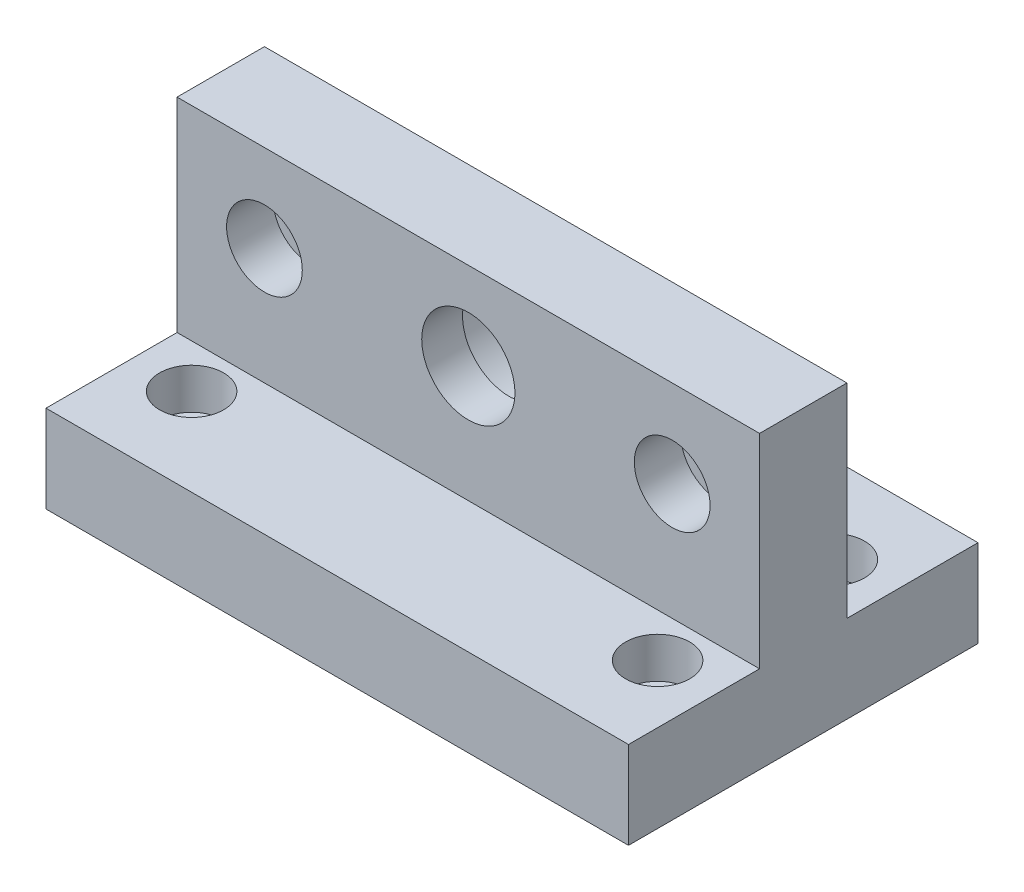
from build123d import *

# Parameters (mm, degrees)
SKETCH_1_W          = 100
SKETCH_1_H          = 35
EXTRUDE_1_DEPTH     = 15
SKETCH_2_W          = 100
SKETCH_2_H          = 60
EXTRUDE_2_DEPTH     = 15
SKETCH_3_R          = 3.5
CUT_EXTRUDE_1_DEPTH = 113.388833965
SKETCH_4_R          = 5.5
CUT_EXTRUDE_2_DEPTH = 7
SKETCH_5_R          = 4.5
SKETCH_5_R_2        = 8
CUT_EXTRUDE_3_DEPTH = 113.388833965
SKETCH_6_R          = 12
CUT_EXTRUDE_4_DEPTH = 8
SKETCH_7_R          = 6.5
CUT_EXTRUDE_5_DEPTH = 8


with BuildPart() as part:
    # 草图1 → 凸台-拉伸1 (new body)
    with BuildSketch(Plane.XY):
        with Locations((50, 17.5)):
            Rectangle(SKETCH_1_W, SKETCH_1_H)
    extrude(amount=EXTRUDE_1_DEPTH)

    # 草图2 → 凸台-拉伸2 (add)
    with BuildSketch(Plane.XZ):
        with Locations((50, 7.5)):
            Rectangle(SKETCH_2_W, SKETCH_2_H)
    extrude(amount=EXTRUDE_2_DEPTH)

    # 草图3 → 切除-拉伸1 (cut, through all)
    with BuildSketch(Plane(origin=(0, 0, 0), x_dir=(1, 0, 0), z_dir=(0, 1, 0))):
        with Locations(Location((10, 7.5, 0), (0, 0, 270))):
            Circle(SKETCH_3_R)
        with Locations(Location((90, 7.5, 0), (0, 0, 270))):
            Circle(SKETCH_3_R)
        with Locations(Location((90, -22.5, 0), (0, 0, 90))):
            Circle(SKETCH_3_R)
        with Locations(Location((10, -22.5, 0), (0, 0, 90))):
            Circle(SKETCH_3_R)
    extrude(amount=-CUT_EXTRUDE_1_DEPTH, mode=Mode.SUBTRACT)

    # 草图4 → 切除-拉伸2 (cut)
    with BuildSketch(Plane(origin=(0, 0, 0), x_dir=(1, 0, 0), z_dir=(0, 1, 0))):
        with Locations(Location((10, 7.5, 0), (0, 0, 270))):
            Circle(SKETCH_4_R)
        with Locations(Location((90, 7.5, 0), (0, 0, 270))):
            Circle(SKETCH_4_R)
        with Locations(Location((10, -22.5, 0), (0, 0, 270))):
            Circle(SKETCH_4_R)
        with Locations(Location((90, -22.5, 0), (0, 0, 270))):
            Circle(SKETCH_4_R)
    extrude(amount=-CUT_EXTRUDE_2_DEPTH, mode=Mode.SUBTRACT)

    # 草图5 → 切除-拉伸3 (cut, through all)
    with BuildSketch(Plane(origin=(0, 0, 0), x_dir=(-1, 0, 0), z_dir=(0, 0, -1))):
        with Locations((-85, 20)):
            Circle(SKETCH_5_R)
        with Locations((-15, 20)):
            Circle(SKETCH_5_R)
        with Locations((-50, 20)):
            Circle(SKETCH_5_R_2)
    extrude(amount=-CUT_EXTRUDE_3_DEPTH, mode=Mode.SUBTRACT)

    # 草图6 → 切除-拉伸4 (cut)
    with BuildSketch(Plane(origin=(0, 0, 0), x_dir=(-1, 0, 0), z_dir=(0, 0, -1))):
        with Locations((-50, 20)):
            Circle(SKETCH_6_R)
    extrude(amount=-CUT_EXTRUDE_4_DEPTH, mode=Mode.SUBTRACT)

    # 草图7 → 切除-拉伸5 (cut)
    with BuildSketch(Plane.XY.offset(15)):
        with Locations((15, 20)):
            Circle(SKETCH_7_R)
        with Locations((85, 20)):
            Circle(SKETCH_7_R)
    extrude(amount=-CUT_EXTRUDE_5_DEPTH, mode=Mode.SUBTRACT)


solid = part.part
